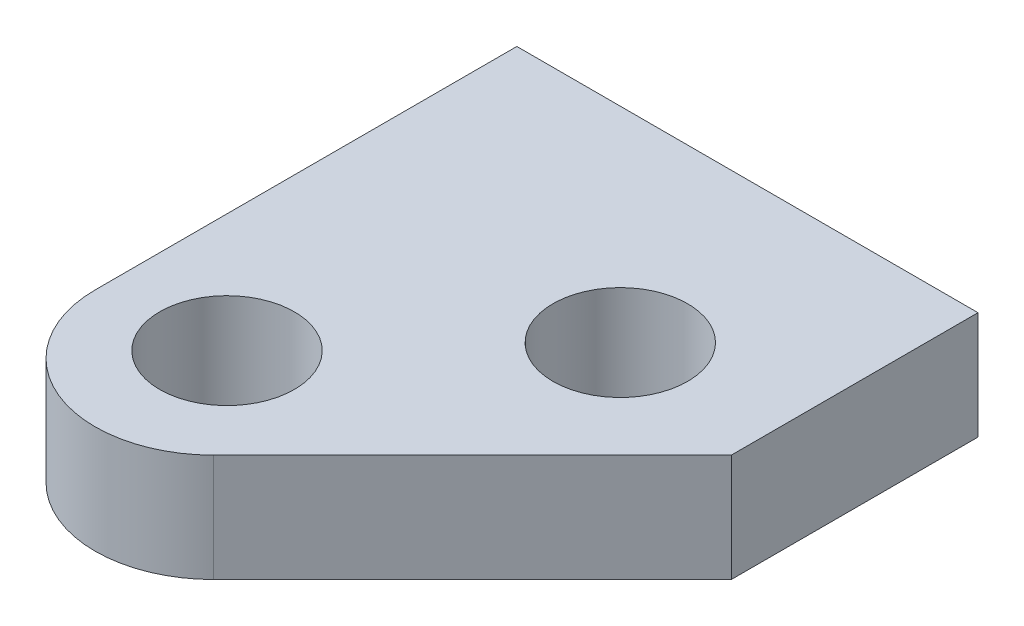
from build123d import *

# Parameters (mm, degrees)
SCHIZZO1_R                   = 6.25
ESTRUSIONE_ESTRUSIONE1_DEPTH = 10
RACCORDO1_R                  = 11
SCHIZZO2_R                   = 1.863588926
TAGLIO_ESTRUSIONE1_DEPTH     = 10


with BuildPart() as part:
    # Schizzo1 → Estrusione-Estrusione1 (new body)
    with BuildSketch(Plane(origin=(0, 0, 0), x_dir=(1, 0, 0), z_dir=(0, 1, 0))):
        Polygon((0, 0), (0, -37.9), (0, -65.7), (42.8, -22.9), (42.8, 0), align=None)
        with Locations(Location((11, -37.9, 0), (0, 0, 270))):
            Circle(SCHIZZO1_R, mode=Mode.SUBTRACT)
        with Locations(Location((28.6, -19, 0), (0, 0, 270))):
            Circle(SCHIZZO1_R, mode=Mode.SUBTRACT)
    extrude(amount=ESTRUSIONE_ESTRUSIONE1_DEPTH)

    # Raccordo1
    raccordo1_edges = [part.edges().sort_by_distance(p)[0] for p in [
        (0, 5, 65.7),
    ]]
    fillet(raccordo1_edges, radius=RACCORDO1_R)

    # Schizzo2 → Taglio-Estrusione1 (cut)
    with BuildSketch(Plane.ZY):
        with Locations((3, 5)):
            Circle(SCHIZZO2_R)
        with Locations((9, 5)):
            Circle(SCHIZZO2_R)
    extrude(amount=-TAGLIO_ESTRUSIONE1_DEPTH, mode=Mode.SUBTRACT)


solid = part.part
